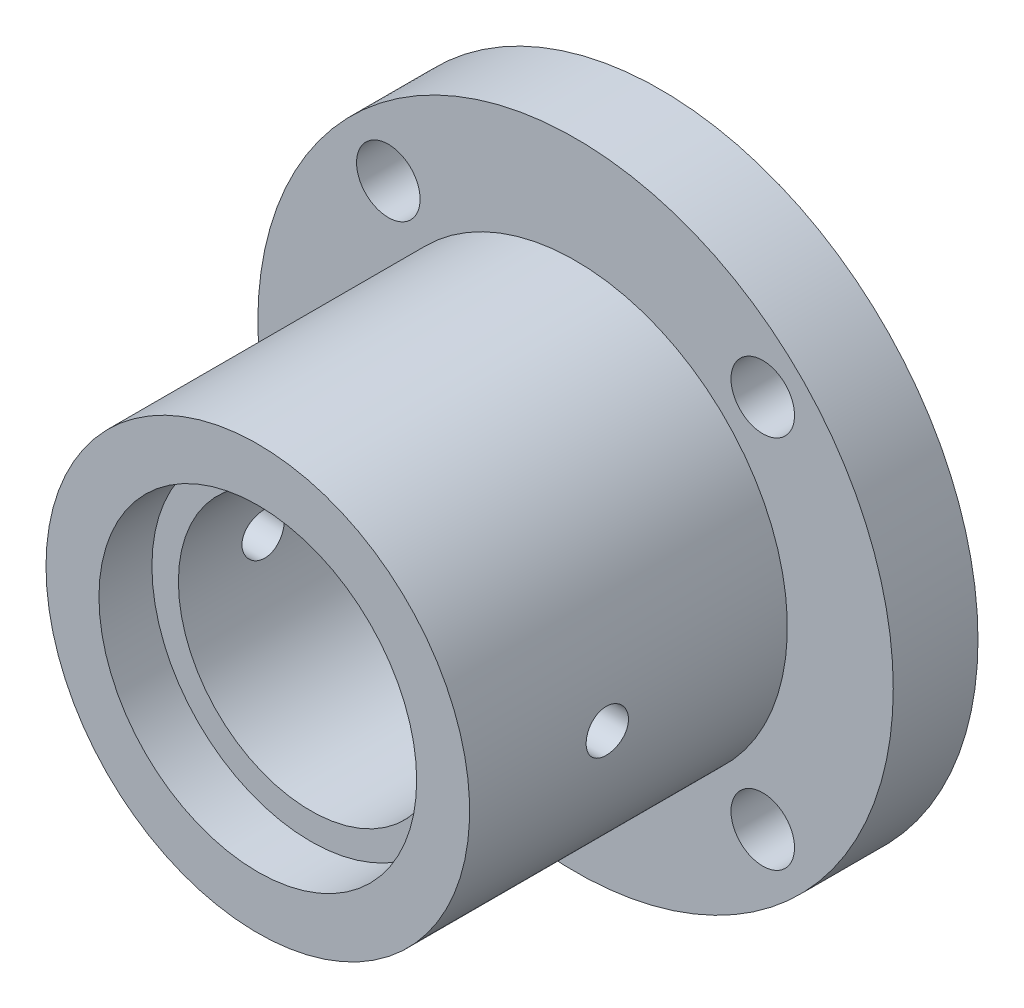
from build123d import *

# Parameters (mm, degrees)
SKETCH_2_R          = 15
CUT_EXTRUDE_1_DEPTH = 5
SKETCH_3_R          = 12.5
CUT_EXTRUDE_2_DEPTH = 57.956123464
SKETCH_5_R          = 3
CUT_EXTRUDE_5_DEPTH = 57.956123464
SKETCH_6_R          = 2
CUT_EXTRUDE_6_DEPTH = 61


with BuildPart() as part:
    # 草图1 → 旋转1 (revolve)
    with BuildSketch(Plane(origin=(0, 0, 0), x_dir=(1, 0, 0), z_dir=(0, 1, 0)), mode=Mode.PRIVATE) as revolve_1_sk:
        Polygon((0, 0), (30, 0), (30, -8), (20, -8), (20, -38), (0, -38), align=None)
    revolve(revolve_1_sk.sketch.rotate(Axis((0, 0, 0), (0, 0, 1)), 180), axis=Axis((0, 0, 0), (0, 0, 1)))

    # 草图2 → 切除-拉伸1 (cut)
    with BuildSketch(Plane.XY.offset(38)):
        Circle(SKETCH_2_R)
    extrude(amount=-CUT_EXTRUDE_1_DEPTH, mode=Mode.SUBTRACT)

    # 草图3 → 切除-拉伸2 (cut, through all)
    with BuildSketch(Plane.XY.offset(38)):
        Circle(SKETCH_3_R)
    extrude(amount=-CUT_EXTRUDE_2_DEPTH, mode=Mode.SUBTRACT)

    # 草图5 → 切除-拉伸5 (cut, through all)
    with BuildSketch(Plane.XY):
        with Locations(Location((17.67767, 17.67767, 0), (0, 0, 180))):
            Circle(SKETCH_5_R)
        with Locations(Location((-17.67767, 17.67767, 0), (0, 0, 180))):
            Circle(SKETCH_5_R)
        with Locations(Location((-17.67767, -17.67767, 0), (0, 0, 180))):
            Circle(SKETCH_5_R)
        with Locations(Location((17.67767, -17.67767, 0), (0, 0, 180))):
            Circle(SKETCH_5_R)
    extrude(amount=CUT_EXTRUDE_5_DEPTH, mode=Mode.SUBTRACT)

    # 草图6 → 切除-拉伸6 (cut, symmetric)
    with BuildSketch(Plane(origin=(0, 0, 0), x_dir=(0, 0, -1), z_dir=(1, 0, 0))):
        with Locations((-25, 0)):
            Circle(SKETCH_6_R)
    extrude(amount=CUT_EXTRUDE_6_DEPTH, both=True, mode=Mode.SUBTRACT)


solid = part.part
